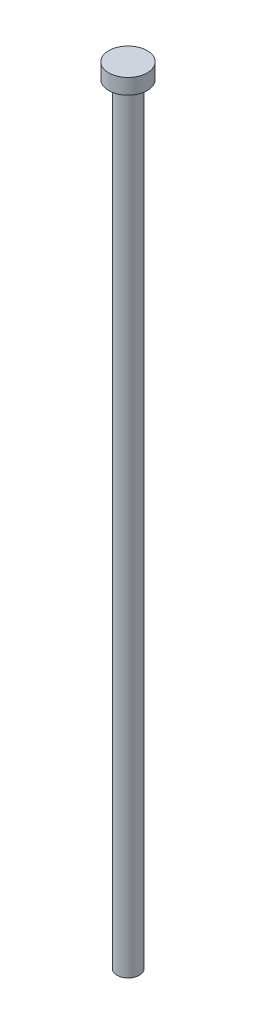
from build123d import *

# Parameters (mm, degrees)
SKETCH1_R           = 1.45
BOSS_EXTRUDE1_DEPTH = 100
SKETCH3_R           = 2.5
BOSS_EXTRUDE3_DEPTH = 2


with BuildPart() as part:
    # Sketch1 → Boss-Extrude1 (new body)
    with BuildSketch(Plane(origin=(0, 0, 0), x_dir=(1, 0, 0), z_dir=(0, 1, 0))):
        with Locations(Location((-0.021698454, 0.046266125, 0), (0, 0, 270))):
            Circle(SKETCH1_R)
    extrude(amount=BOSS_EXTRUDE1_DEPTH)

    # Sketch3 → Boss-Extrude3 (add)
    with BuildSketch(Plane(origin=(0, 100, 0), x_dir=(1, 0, 0), z_dir=(0, 1, 0))):
        with Locations(Location((0.010729748, -0.006302729, 0), (0, 0, 270))):
            Circle(SKETCH3_R)
    extrude(amount=BOSS_EXTRUDE3_DEPTH)


solid = part.part
